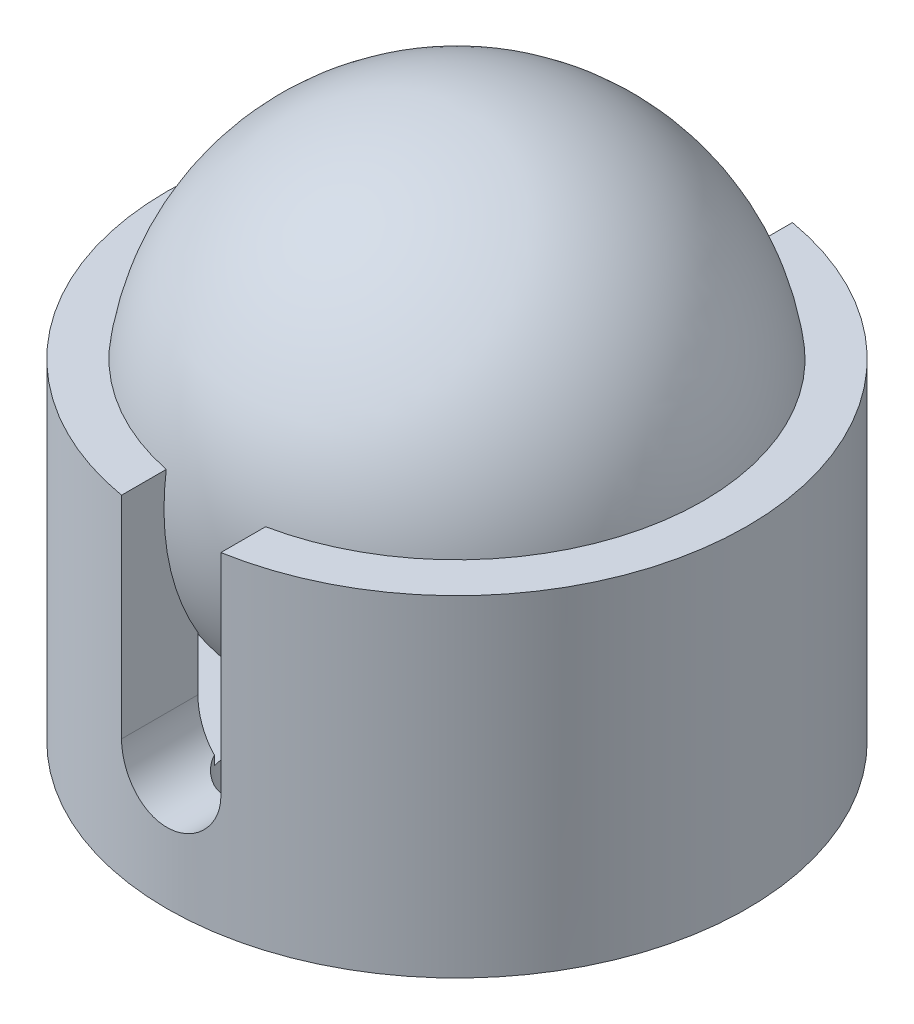
from build123d import *

# Parameters (mm, degrees)
SKETCH1_R           = 11.1252
BOSS_EXTRUDE1_DEPTH = 12.7
SKETCH4_R           = 8.255
CUT_EXTRUDE2_DEPTH  = 10
CUT_EXTRUDE1_DEPTH  = 28.930993094
CUT_EXTRUDE3_REACH  = 28.204
SKETCH5_R           = 1.2065


with BuildPart() as part:
    # Sketch1 → Boss-Extrude1 (new body)
    with BuildSketch(Plane(origin=(0, 0, 0), x_dir=(1, 0, 0), z_dir=(0, 1, 0))):
        Circle(SKETCH1_R)
    extrude(amount=BOSS_EXTRUDE1_DEPTH)

    # Sketch4 → Cut-Extrude2 (cut)
    with BuildSketch(Plane(origin=(0, 12.7, 0), x_dir=(1, 0, 0), z_dir=(0, 1, 0))):
        Circle(SKETCH4_R)
    extrude(amount=-CUT_EXTRUDE2_DEPTH, mode=Mode.SUBTRACT)

    # Sketch3 → Cut-Extrude1 (cut, through all)
    with BuildSketch(Plane(origin=(0, 0, -11.1252), x_dir=(-1, 0, 0), z_dir=(0, 0, -1))):
        with BuildLine():
            Line((-1.905, 12.7), (-1.905, 4.605))
            ThreePointArc((-1.905, 4.605), (0, 2.7), (1.905, 4.605))
            Line((1.905, 4.605), (1.905, 12.7))
            Line((1.905, 12.7), (-1.905, 12.7))
        make_face()
    extrude(amount=-CUT_EXTRUDE1_DEPTH, mode=Mode.SUBTRACT)

    # Sketch2 → Revolve3 (revolve)
    with BuildSketch(Plane.XY):
        with BuildLine():
            Line((0, 20.955), (0, 1.905))
            ThreePointArc((0, 1.905), (9.525, 11.43), (0, 20.955))
        make_face()
    revolve(axis=Axis((0, 20.955, 0), (0, -1, 0)))

    # Sketch5 → Cut-Extrude3 (cut, up to next)
    with BuildSketch(Plane.XZ, mode=Mode.PRIVATE) as cut_extrude3_sk1:
        with Locations((0, 7.747)):
            Circle(SKETCH5_R)
    cut_extrude3_tool1 = extrude(cut_extrude3_sk1.sketch, amount=-CUT_EXTRUDE3_REACH, mode=Mode.PRIVATE) & part.part
    # Sketch5 → Cut-Extrude3 (cut, up to next)
    with BuildSketch(Plane.XZ, mode=Mode.PRIVATE) as cut_extrude3_sk2:
        with Locations((0, -7.747)):
            Circle(SKETCH5_R)
    cut_extrude3_tool2 = extrude(cut_extrude3_sk2.sketch, amount=-CUT_EXTRUDE3_REACH, mode=Mode.PRIVATE) & part.part
    add(cut_extrude3_tool1.solids().sort_by_distance((0, 0, 7.747))[0], mode=Mode.SUBTRACT)
    add(cut_extrude3_tool2.solids().sort_by_distance((0, 0, -7.747))[0], mode=Mode.SUBTRACT)


solid = part.part
